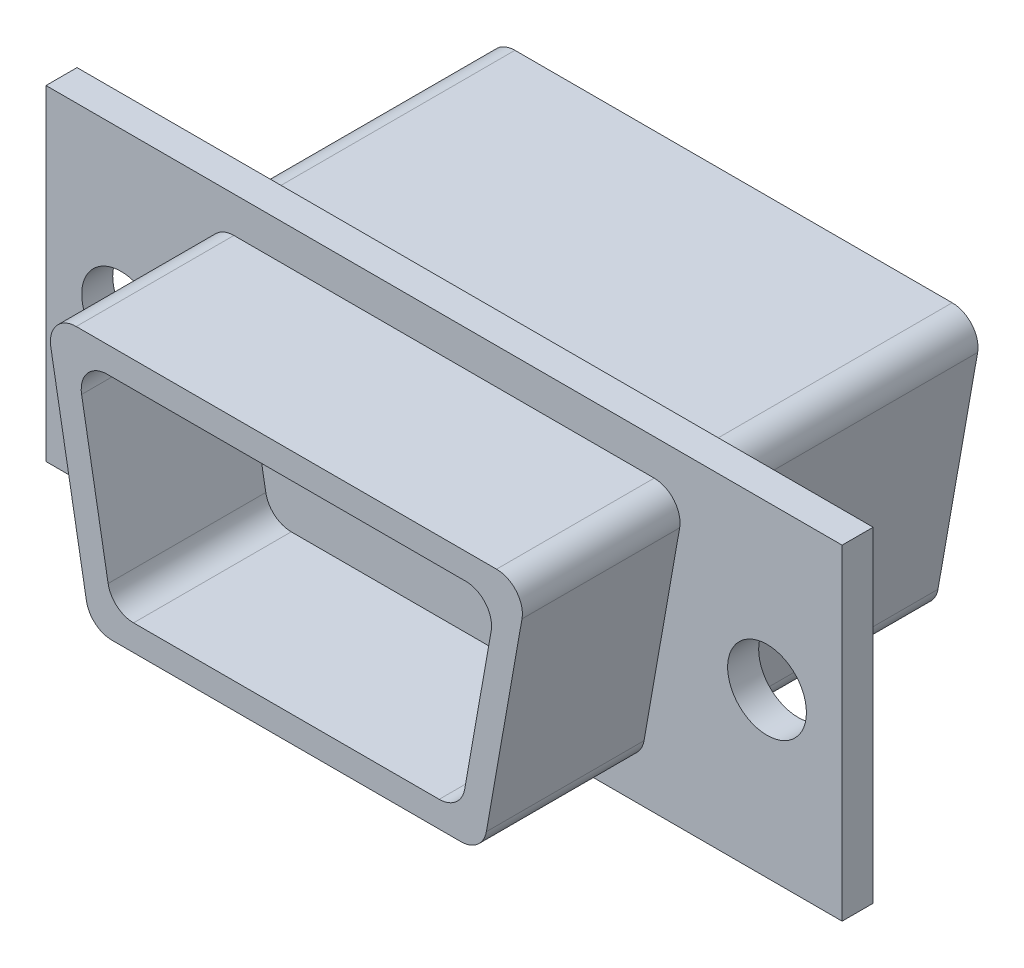
from build123d import *

# Parameters (mm, degrees)
SKETCH_1_W             = 30.8
SKETCH_1_H             = 12.6
EXTRUDE_1_DEPTH        = 1.2
EXTRUDE_2_DEPTH        = 6.1
EXTRUDE_3_DEPTH        = 10
HOLE_WIZARD_0000_1_D   = 0.7112
HOLE_WIZARD_0000_2_D   = 0.7112
PATTERN_LINEAR_1_COUNT = 5
PATTERN_LINEAR_1_PITCH = 2.54
PATTERN_LINEAR_2_COUNT = 4
PATTERN_LINEAR_2_PITCH = 2.54
HOLE_WIZARD_3_2_D      = 3.048
FILLET_1_R             = 1


with BuildPart() as part:
    # ｽｹｯﾁ1 → ﾎﾞｽ - 押し出し1 (new body)
    with BuildSketch(Plane.XY):
        Rectangle(SKETCH_1_W, SKETCH_1_H)
    extrude(amount=EXTRUDE_1_DEPTH)

    # ｽｹｯﾁ2 → ﾎﾞｽ - 押し出し2 (add)
    with BuildSketch(Plane.XY.offset(1.2)):
        Polygon((-9.321753593, 4.91), (9.321753593, 4.91), (7.590222642, -4.91), (-7.590222642, -4.91), align=None)
        Polygon((-6.751123011, -3.91), (6.751123011, -3.91), (8.13, 3.91), (-8.13, 3.91), align=None, mode=Mode.SUBTRACT)
    extrude(amount=EXTRUDE_2_DEPTH)

    # ｽｹｯﾁ3 → ﾎﾞｽ - 押し出し3 (add)
    with BuildSketch(Plane(origin=(0, 0, 0), x_dir=(-1, 0, 0), z_dir=(0, 0, -1))):
        Polygon((-7.763301306, -5.35), (7.763301306, -5.35), (9.65, 5.35), (-9.65, 5.35), align=None)
    extrude(amount=EXTRUDE_3_DEPTH)

    # #0000 すきま穴1 (through all)
    with Locations(Plane(origin=(-4.225439316, 1.008007938, 1.2), x_dir=(1, 0, 0), z_dir=(0, 0, 1))):
        with Locations((0, 0)):
            hole_wizard_0000_1 = Hole(HOLE_WIZARD_0000_1_D / 2)

    # #0000 すきま穴2 (through all)
    with Locations(Plane(origin=(-3.168321124, -1.202810505, 1.2), x_dir=(1, 0, 0), z_dir=(0, 0, 1))):
        with Locations((0, 0)):
            hole_wizard_0000_2 = Hole(HOLE_WIZARD_0000_2_D / 2)

    # 直線ﾊﾟﾀｰﾝ1: #0000 すきま穴1 ×5
    with Locations(*[(i * PATTERN_LINEAR_1_PITCH, 0, 0) for i in range(1, PATTERN_LINEAR_1_COUNT)]):
        add(hole_wizard_0000_1, mode=Mode.SUBTRACT)

    # 直線ﾊﾟﾀｰﾝ2: #0000 すきま穴2 ×4
    with Locations(*[(i * PATTERN_LINEAR_2_PITCH, 0, 0) for i in range(1, PATTERN_LINEAR_2_COUNT)]):
        add(hole_wizard_0000_2, mode=Mode.SUBTRACT)

    # #3 すきま穴2 (through all)
    with Locations(Plane(origin=(-12.495, 0, 1.2), x_dir=(1, 0, 0), z_dir=(0, 0, 1))):
        with Locations((0, 0), (24.99, 0)):
            Hole(HOLE_WIZARD_3_2_D / 2)

    # ﾌｨﾚｯﾄ1
    fillet_1_edges = [part.edges().sort_by_distance(p)[0] for p in [
        (-9.321753593, 4.91, 4.25),
        (-7.590222642, -4.91, 4.25),
        (7.590222642, -4.91, 4.25),
        (9.321753593, 4.91, 4.25),
        (8.13, 3.91, 4.25),
        (-8.13, 3.91, 4.25),
        (-6.751123011, -3.91, 4.25),
        (6.751123011, -3.91, 4.25),
        (-7.763301306, -5.35, -5),
        (-9.65, 5.35, -5),
        (9.65, 5.35, -5),
        (7.763301306, -5.35, -5),
    ]]
    fillet(fillet_1_edges, radius=FILLET_1_R)


solid = part.part
